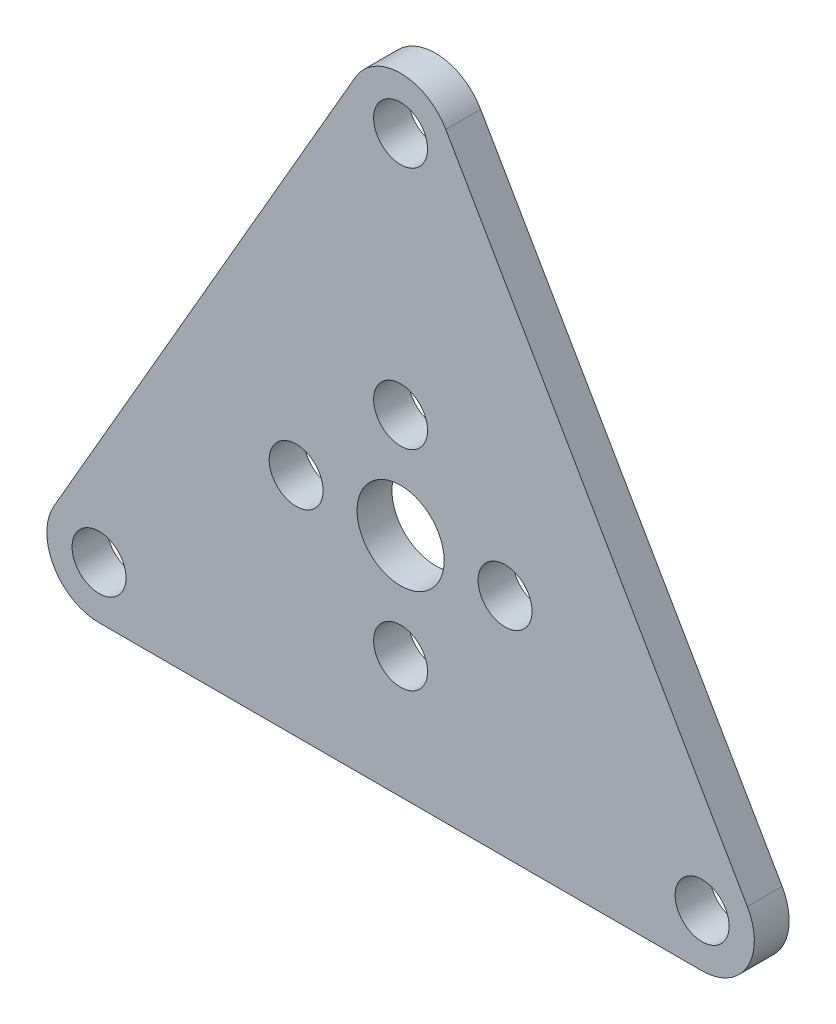
from build123d import *

# Parameters (mm, degrees)
SKETCH_1_R          = 1.55
EXTRUDE_1_DEPTH     = 2
SKETCH_2_R          = 1.55
CUT_EXTRUDE_1_DEPTH = 3
SKETCH_4_R          = 2.5
CUT_EXTRUDE_2_DEPTH = 3


with BuildPart() as part:
    # 草图1 → 凸台-拉伸1 (new body)
    with BuildSketch(Plane.XY):
        with BuildLine():
            Line((-2.598076211, 21.5), (-19.918584287, -8.5))
            ThreePointArc((-19.918584287, -8.5), (-19.918584287, -11.5), (-17.320508076, -13))
            Line((-17.320508076, -13), (17.320508076, -13))
            ThreePointArc((17.320508076, -13), (19.918584287, -11.5), (19.918584287, -8.5))
            Line((19.918584287, -8.5), (2.598076211, 21.5))
            ThreePointArc((2.598076211, 21.5), (0, 23), (-2.598076211, 21.5))
        make_face()
        with Locations((0, 20)):
            Circle(SKETCH_1_R, mode=Mode.SUBTRACT)
        with Locations((17.320508076, -10)):
            Circle(SKETCH_1_R, mode=Mode.SUBTRACT)
        with Locations((-17.320508076, -10)):
            Circle(SKETCH_1_R, mode=Mode.SUBTRACT)
    extrude(amount=EXTRUDE_1_DEPTH)

    # 草图2 → 切除-拉伸1 (cut)
    with BuildSketch(Plane.XY.offset(2)):
        with Locations((0, 6)):
            Circle(SKETCH_2_R)
        with Locations((6, 0)):
            Circle(SKETCH_2_R)
        with Locations((0, -6)):
            Circle(SKETCH_2_R)
        with Locations((-6, 0)):
            Circle(SKETCH_2_R)
    extrude(amount=-CUT_EXTRUDE_1_DEPTH, mode=Mode.SUBTRACT)

    # 草图4 → 切除-拉伸2 (cut)
    with BuildSketch(Plane.XY.offset(2)):
        Circle(SKETCH_4_R)
    extrude(amount=-CUT_EXTRUDE_2_DEPTH, mode=Mode.SUBTRACT)


solid = part.part
